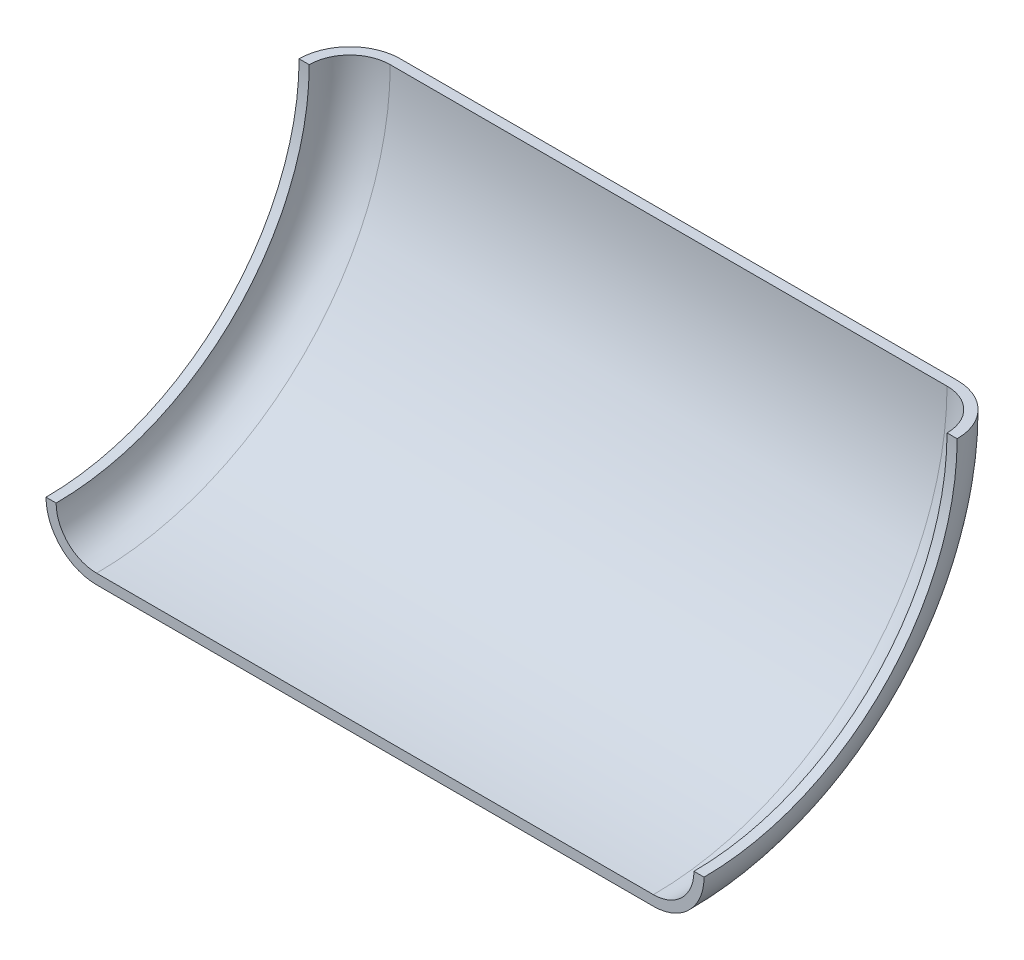
from build123d import *


with BuildPart() as part:
    # Sweep1: sweep along a path in Sketch2
    with BuildLine(Plane(origin=(0, 0, 0), x_dir=(0, 0, -1), z_dir=(1, 0, 0))) as sweep1_path:
        ThreePointArc((0, 0), (53.881536726, 22.318463274), (76.2, 76.2))
    # Sketch1 → Sweep1 (sweep)
    with BuildSketch(Plane.XY):
        with BuildLine():
            Line((-69.85, 0), (69.85, 0))
            ThreePointArc((69.85, 0), (78.830256121, 3.719743879), (82.55, 12.7))
            Line((82.55, 12.7), (80.01, 12.7))
            ThreePointArc((80.01, 12.7), (77.034204897, 5.515795103), (69.85, 2.54))
            Line((69.85, 2.54), (-69.85, 2.54))
            ThreePointArc((-69.85, 2.54), (-77.034204897, 5.515795103), (-80.01, 12.7))
            Line((-80.01, 12.7), (-82.55, 12.7))
            ThreePointArc((-82.55, 12.7), (-78.830256121, 3.719743879), (-69.85, 0))
        make_face()
    sweep(path=sweep1_path.line)


solid = part.part
